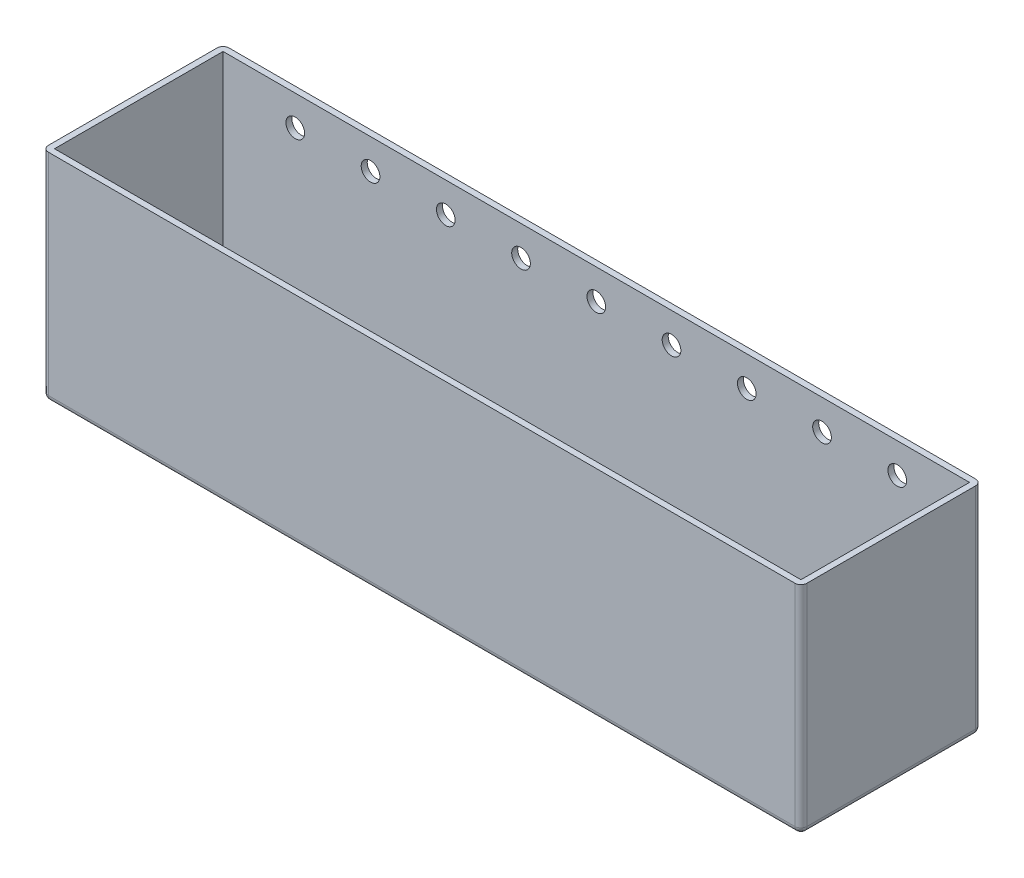
from build123d import *

# Parameters (mm, degrees)
SKETCH_1_W          = 126
SKETCH_1_H          = 30
EXTRUDE_1_DEPTH     = 36
SHELL_1_T           = -1
SKETCH_2_W          = 18
SKETCH_2_H          = 8.5
CUT_EXTRUDE_1_DEPTH = 12
SKETCH_4_R          = 1.55
SKETCH_4_R_2        = 0.018181818
CUT_EXTRUDE_2_DEPTH = 12
FILLET_1_R          = 1
SKETCH_5_R          = 1.55
CUT_EXTRUDE_3_DEPTH = 10


with BuildPart() as part:
    # 草图1 → 凸台-拉伸1 (new body)
    with BuildSketch(Plane(origin=(0, 0, 0), x_dir=(1, 0, 0), z_dir=(0, 1, 0))):
        with Locations((3.814267375, 21.950874785)):
            Rectangle(SKETCH_1_W, SKETCH_1_H)
    extrude(amount=EXTRUDE_1_DEPTH)

    # 抽壳1
    shell_1_openings = [part.faces().sort_by_distance(p)[0] for p in [
        (3.814267375, 36, -21.950874785),
    ]]
    offset(amount=SHELL_1_T, openings=shell_1_openings, kind=Kind.INTERSECTION)

    # 草图2 → 切除-拉伸1 (cut)
    with BuildSketch(Plane.ZY.offset(59.185732625)):
        with Locations((-21.950874785, 4.25)):
            Rectangle(SKETCH_2_W, SKETCH_2_H)
    extrude(amount=-CUT_EXTRUDE_1_DEPTH, mode=Mode.SUBTRACT)

    # 草图4 → 切除-拉伸2 (cut)
    # profile 1 of 5: a face of its own
    with BuildSketch(Plane.XZ):
        with Locations(Location((-13.447304323, -21.950874785, 0), (0, 0, 270))):
            Circle(SKETCH_4_R)
        with Locations(Location((-13.447304323, -21.950874785, 0), (0, 0, 270))):
            Circle(SKETCH_4_R_2, mode=Mode.SUBTRACT)
    # profile 2 of 5: a face of its own
    with BuildSketch(Plane.XZ):
        with Locations(Location((4.302695677, -21.950874785, 0), (0, 0, 270))):
            Circle(SKETCH_4_R)
    # profile 3 of 5: a face of its own
    with BuildSketch(Plane.XZ):
        with Locations(Location((22.052695677, -21.950874785, 0), (0, 0, 270))):
            Circle(SKETCH_4_R)
    # profile 4 of 5: a face of its own
    with BuildSketch(Plane.XZ):
        with Locations(Location((51.945468235, -17.942457274, 0), (0, 0, 270))):
            Circle(SKETCH_4_R)
    # profile 5 of 5: a face of its own
    with BuildSketch(Plane.XZ):
        with Locations(Location((52.0558492, -32.788697079, 0), (0, 0, 270))):
            Circle(SKETCH_4_R)
    extrude(amount=-CUT_EXTRUDE_2_DEPTH, mode=Mode.SUBTRACT)


with BuildPart() as cut_extrude_2_piece_1:
    # of the separate pieces the step leaves, piece 1, a body of its own (cut_extrude_2_pieces)
    add(part.part.solids().sort_by_distance((-59.185732625, 0, -36.950874785))[0])

    # 圆角1
    fillet_1_edges = [cut_extrude_2_piece_1.edges().sort_by_distance(p)[0] for p in [
        (-59.185732625, 0, -33.950874785),
        (-59.185732625, 0, -9.950874785),
        (-59.185732625, 18, -36.950874785),
        (3.814267375, 0, -6.950874785),
        (-59.185732625, 18, -6.950874785),
        (66.814267375, 0, -21.950874785),
        (66.814267375, 18, -6.950874785),
        (3.814267375, 0, -36.950874785),
        (66.814267375, 18, -36.950874785),
    ]]
    fillet(fillet_1_edges, radius=FILLET_1_R)

    # 草图5 → 切除-拉伸3 (cut)
    with BuildSketch(Plane(origin=(0, 0, -36.950874785), x_dir=(-1, 0, 0), z_dir=(0, 0, -1))):
        with Locations((-28.814267375, 31)):
            Circle(SKETCH_5_R)
        with Locations((-53.814267375, 31)):
            Circle(SKETCH_5_R)
        with Locations((-3.814267375, 31)):
            Circle(SKETCH_5_R)
        with Locations((21.185732625, 31)):
            Circle(SKETCH_5_R)
        with Locations((46.185732625, 31)):
            Circle(SKETCH_5_R)
        with Locations((-41.314267375, 31)):
            Circle(SKETCH_5_R)
        with Locations((-16.314267375, 31)):
            Circle(SKETCH_5_R)
        with Locations(Location((8.685732625, 31, 0), (0, 0, 180))):
            Circle(SKETCH_5_R)
        with Locations(Location((33.685732625, 31, 0), (0, 0, 180))):
            Circle(SKETCH_5_R)
    extrude(amount=-CUT_EXTRUDE_3_DEPTH, mode=Mode.SUBTRACT)


with BuildPart() as cut_extrude_2_piece_2:
    # of the separate pieces the step leaves, piece 2, a body of its own (cut_extrude_2_pieces)
    add(part.part.solids().sort_by_distance((-13.447304323, 0, -21.969056603))[0])


solid = Compound([cut_extrude_2_piece_1.part, cut_extrude_2_piece_2.part])
